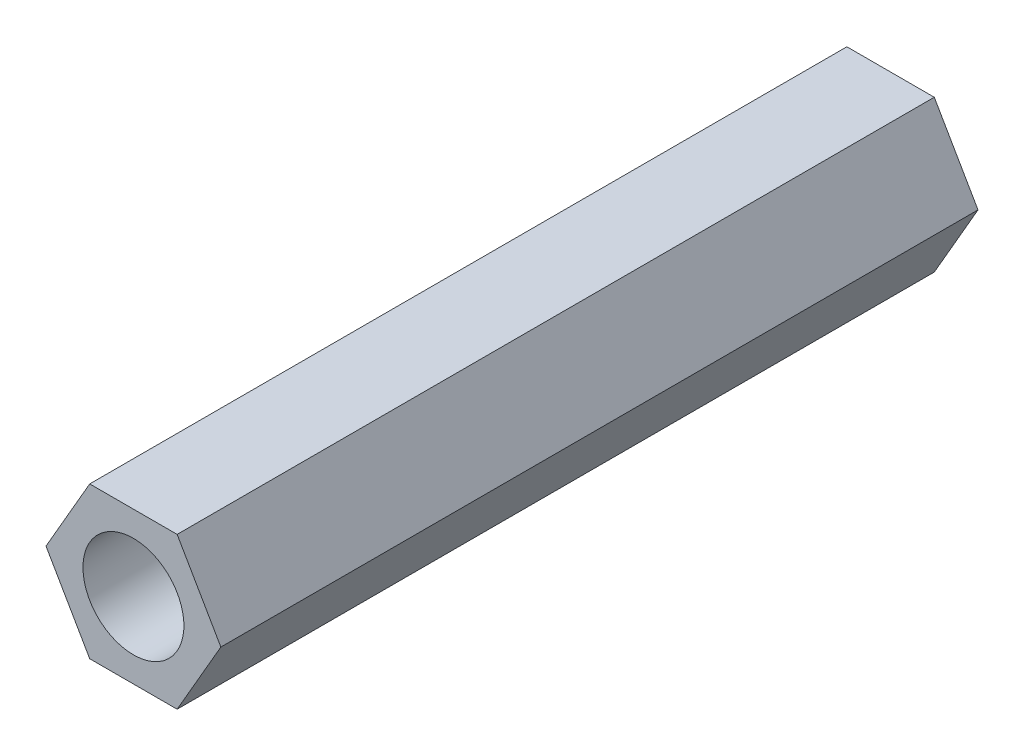
from build123d import *

# Parameters (mm, degrees)
SKETCH_1_R      = 4
EXTRUDE_1_DEPTH = 60


with BuildPart() as part:
    # 草图1 → 凸台-拉伸1 (new body)
    with BuildSketch(Plane(origin=(0, 0, 0), x_dir=(-1, 0, 0), z_dir=(0, 0, -1))):
        Polygon((3.464101615, -6), (6.92820323, 0), (3.464101615, 6), (-3.464101615, 6), (-6.92820323, 0), (-3.464101615, -6), align=None)
        Circle(SKETCH_1_R, mode=Mode.SUBTRACT)
    extrude(amount=-EXTRUDE_1_DEPTH)


solid = part.part
